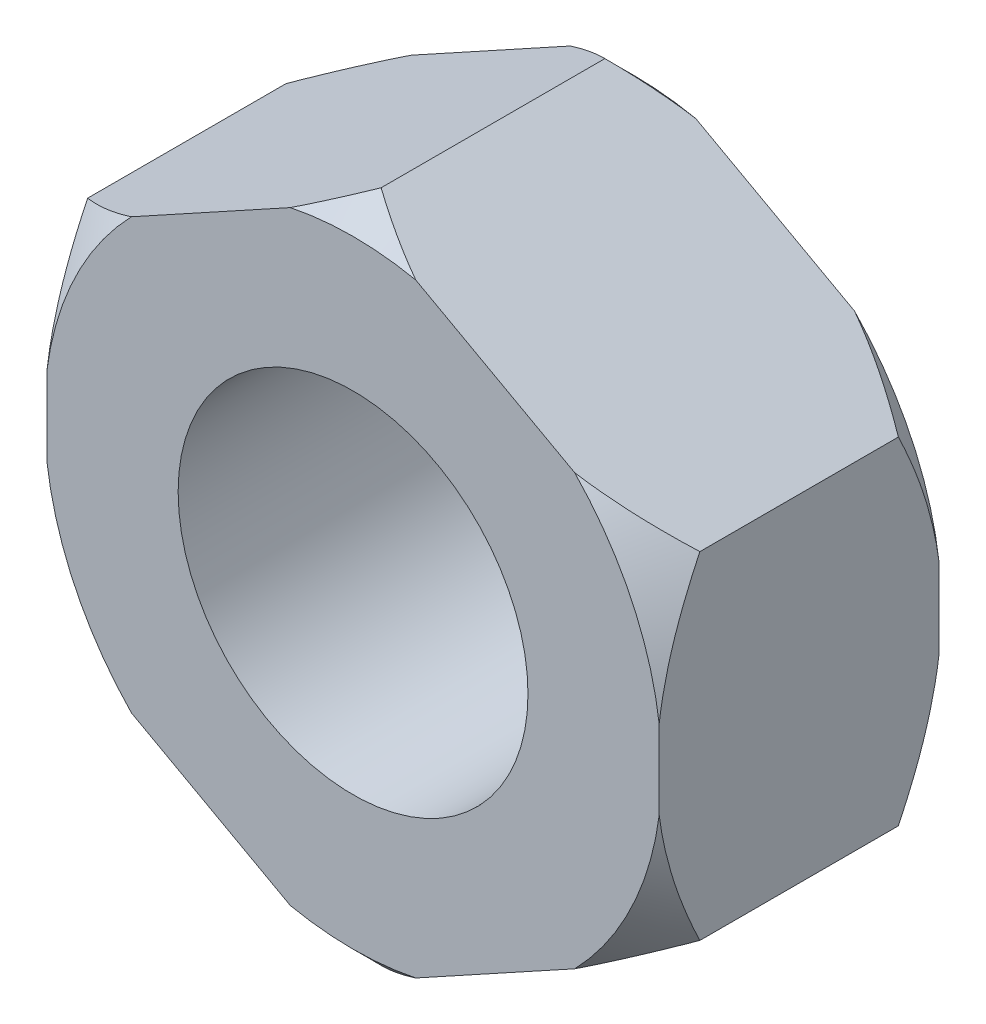
from build123d import *

# Parameters (mm, degrees)
SKETCH1_R = 2
NUT_DEPTH = 3.2


with BuildPart() as part:
    # Sketch1 → NUT (new body)
    with BuildSketch(Plane.XY):
        Polygon((-3.5, -1.925), (-3.5, 1.925), (0, 3.85), (3.5, 1.925), (3.5, -1.925), (0, -3.85), align=None)
        Circle(SKETCH1_R, mode=Mode.SUBTRACT)
    extrude(amount=NUT_DEPTH)

    # Sketch2 → Cut-Revolve1 (revolve, cut)
    with BuildSketch(Plane(origin=(0, 0, 0), x_dir=(0, 0, -1), z_dir=(1, 0, 0))):
        Polygon((-3.2, 3.529166667), (-2.442806488, 4.286360178), (-3.2, 4.286360178), (-3.2, 3.85), align=None)
        Polygon((0, 4.286360178), (-0.757193512, 4.286360178), (0, 3.529166667), (0, 3.85), align=None)
    revolve(axis=Axis((0, 0, 3.2), (0, 0, -1)), mode=Mode.SUBTRACT)


solid = part.part
